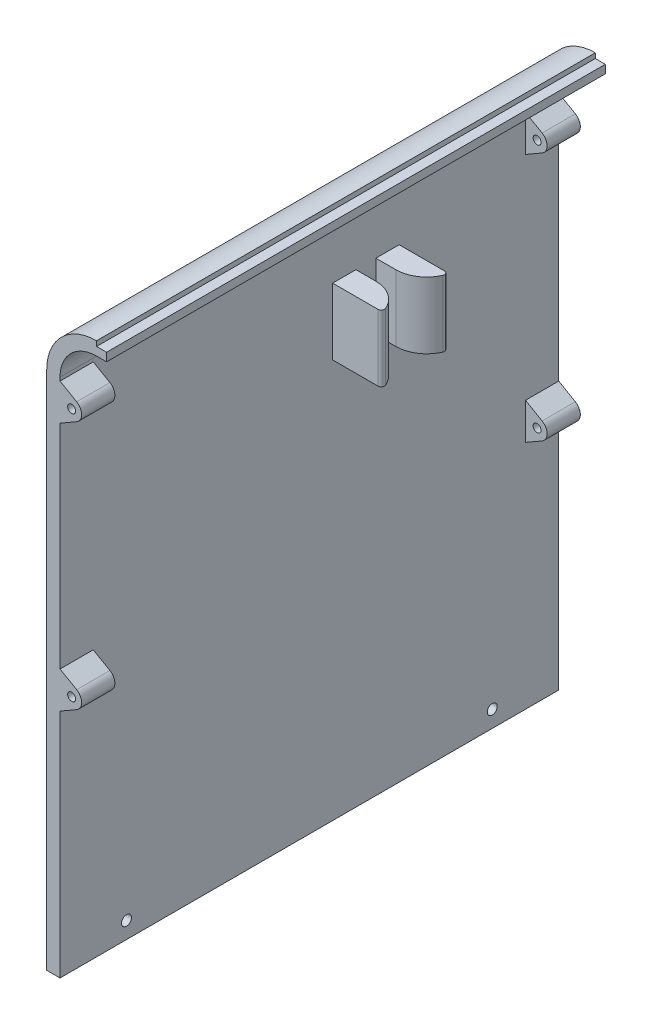
from build123d import *

# Parameters (mm, degrees)
EXTRU_MINCE1_DEPTH                   = 75
ESQUISSE2_R                          = 1.5
ENL_V_MAT_EXTRU_1_DEPTH              = 188.782453919
ESQUISSE3_W                          = 3
ESQUISSE3_H                          = 2.5
BOSS_EXTRU_1_DEPTH                   = 150
ESQUISSE4_R                          = 1.2
BOSS_EXTRU_2_DEPTH                   = 10
R_P_TITION_LIN_AIRE1_COUNT           = 2
R_P_TITION_LIN_AIRE1_PITCH           = 75
R_P_TITION_LIN_AIRE1_COPY_1_SKETCH_R = 1.2
R_P_TITION_LIN_AIRE1_COPY_1_DEPTH    = 10
BOSS_EXTRU_3_START                   = -120
BOSS_EXTRU_3_DEPTH                   = 20
CONG_1_R                             = 1


with BuildPart() as part:
    # Esquisse1 → Extru.-Mince1 (new, symmetric)
    with BuildSketch(Plane.XY):
        with BuildLine():
            Line((0, 0), (0, 156.5))
            ThreePointArc((0, 156.5), (4.393398282, 167.106601718), (15, 171.5))
            Line((15, 171.5), (15, 167.5))
            ThreePointArc((15, 167.5), (7.221825407, 164.278174593), (4, 156.5))
            Line((4, 156.5), (4, 0))
            Line((4, 0), (0, 0))
        make_face()
    extrude(amount=EXTRU_MINCE1_DEPTH, both=True)

    # Esquisse2 → Enlèv. mat.-Extru.1 (cut, through all)
    with BuildSketch(Plane.ZY):
        with Locations((-55, 5)):
            Circle(ESQUISSE2_R)
        with Locations((55, 5)):
            Circle(ESQUISSE2_R)
    extrude(amount=-ENL_V_MAT_EXTRU_1_DEPTH, mode=Mode.SUBTRACT)

    # Esquisse3 → Boss.-Extru.1 (add)
    with BuildSketch(Plane.XY.offset(75)):
        with Locations((16.5, 168.75)):
            Rectangle(ESQUISSE3_W, ESQUISSE3_H)
    extrude(amount=-BOSS_EXTRU_1_DEPTH)

    # Esquisse4 → Boss.-Extru.2 (add)
    with BuildSketch(Plane.XY.offset(75)):
        with BuildLine():
            Line((4, 155.484827557), (9, 152.598076211))
            ThreePointArc((9, 152.598076211), (10.5, 150), (9, 147.401923789))
            Line((9, 147.401923789), (4, 144.515172443))
            Line((4, 144.515172443), (4, 155.484827557))
        make_face()
        with Locations((7.5, 150)):
            Circle(ESQUISSE4_R, mode=Mode.SUBTRACT)
    boss_extru_2 = extrude(amount=-BOSS_EXTRU_2_DEPTH)

    # Symétrie1: Boss.-Extru.2 across plane
    add(boss_extru_2.mirror(Plane.XY))

    # Répétition linéaire1: Boss.-Extru.2 ×2
    with Locations(*[(0, -i * R_P_TITION_LIN_AIRE1_PITCH, 0) for i in range(1, R_P_TITION_LIN_AIRE1_COUNT)]):
        add(boss_extru_2)

    # Répétition linéaire1 copy 1 sketch → Répétition linéaire1 copy 1 (add)
    with BuildSketch(Plane(origin=(0, -75, -75), x_dir=(1, 0, 0), z_dir=(0, 0, -1))):
        with BuildLine():
            Line((4, -155.484827557), (9, -152.598076211))
            ThreePointArc((9, -152.598076211), (10.5, -150), (9, -147.401923789))
            Line((9, -147.401923789), (4, -144.515172443))
            Line((4, -144.515172443), (4, -155.484827557))
        make_face()
        with Locations((7.5, -150)):
            Circle(R_P_TITION_LIN_AIRE1_COPY_1_SKETCH_R, mode=Mode.SUBTRACT)
    extrude(amount=-R_P_TITION_LIN_AIRE1_COPY_1_DEPTH)

    # Esquisse5 → Boss.-Extru.3 (add)
    with BuildSketch(Plane.XZ.offset(BOSS_EXTRU_3_START)):
        with BuildLine():
            Line((4, -14), (10, -14))
            ThreePointArc((10, -14), (15.700877125, -12.043984876), (19, -7))
            Line((19, -7), (4, -7))
            Line((4, -7), (4, -14))
        make_face()
        with BuildLine():
            Line((4, -27), (4, -20))
            Line((4, -20), (10, -20))
            ThreePointArc((10, -20), (15.700877125, -21.956015124), (19, -27))
            Line((19, -27), (4, -27))
        make_face()
    extrude(amount=-BOSS_EXTRU_3_DEPTH)

    # Congé1
    cong_1_edges = [part.edges().sort_by_distance(p)[0] for p in [
        (19, 130, -7),
        (19, 130, -27),
    ]]
    fillet(cong_1_edges, radius=CONG_1_R)


solid = part.part
